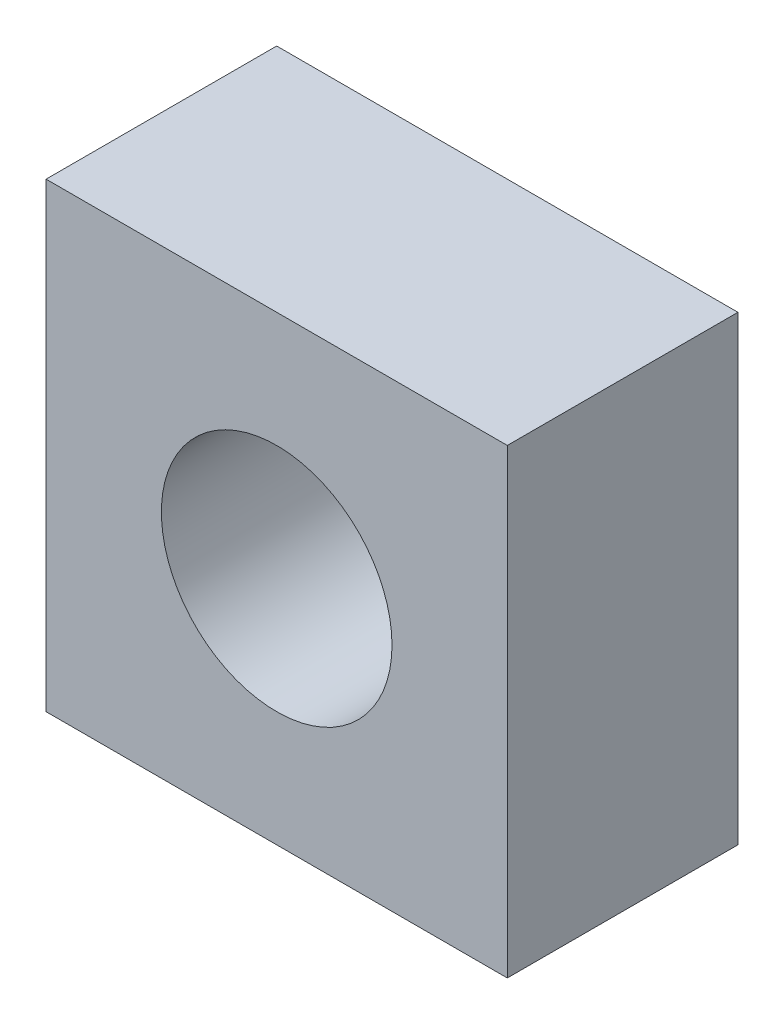
from build123d import *

# Parameters (mm, degrees)
SKETCH1_W           = 40
SKETCH1_H           = 40
SKETCH1_R           = 10
BOSS_EXTRUDE1_DEPTH = 20


with BuildPart() as part:
    # Sketch1 → Boss-Extrude1 (new body)
    with BuildSketch(Plane.XY):
        with Locations((20, 20)):
            Rectangle(SKETCH1_W, SKETCH1_H)
        with Locations((20, 20)):
            Circle(SKETCH1_R, mode=Mode.SUBTRACT)
    extrude(amount=BOSS_EXTRUDE1_DEPTH)


solid = part.part
